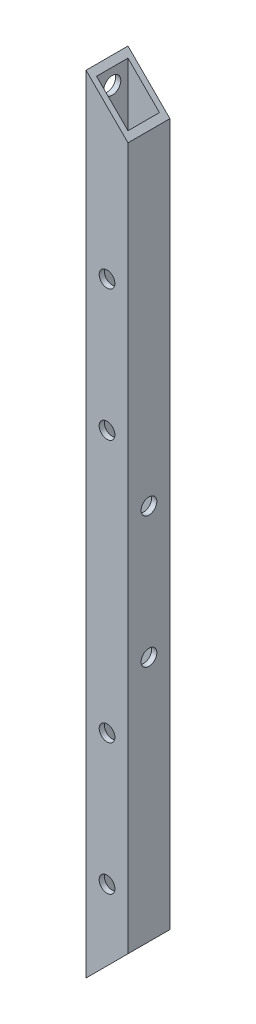
from build123d import *

# Parameters (mm, degrees)
SKETCH_1_W          = 8
SKETCH_1_H          = 8
SKETCH_1_W_2        = 6
SKETCH_1_H_2        = 6
EXTRUDE_1_DEPTH     = 150
SKETCH_2_R          = 1.5
CUT_EXTRUDE_1_DEPTH = 10
CUT_EXTRUDE_2_DEPTH = 10
SKETCH_5_R          = 1.5
CUT_EXTRUDE_3_DEPTH = 10
SKETCH_6_R          = 1.625
CUT_EXTRUDE_4_DEPTH = 10


with BuildPart() as part:
    # 草图1 → 凸台-拉伸1 (new body)
    with BuildSketch(Plane(origin=(0, 0, 0), x_dir=(1, 0, 0), z_dir=(0, 1, 0))):
        Rectangle(SKETCH_1_W, SKETCH_1_H)
        Rectangle(SKETCH_1_W_2, SKETCH_1_H_2, mode=Mode.SUBTRACT)
    extrude(amount=EXTRUDE_1_DEPTH)

    # 草图2 → 切除-拉伸1 (cut)
    with BuildSketch(Plane(origin=(4, 0, 0), x_dir=(0, 0, -1), z_dir=(1, 0, 0))):
        with Locations((0, 80)):
            Circle(SKETCH_2_R)
        with Locations((0, 55)):
            Circle(SKETCH_2_R)
    extrude(amount=-CUT_EXTRUDE_1_DEPTH, mode=Mode.SUBTRACT)

    # 草图3 → 切除-拉伸2 (cut)
    with BuildSketch(Plane(origin=(0, 0, -4), x_dir=(-1, 0, 0), z_dir=(0, 0, -1))):
        Polygon((4, 150), (-4, 142), (-4, 150), align=None)
        Polygon((4, 0), (-4, 8), (-4, 0), align=None)
    extrude(amount=-CUT_EXTRUDE_2_DEPTH, mode=Mode.SUBTRACT)

    # 草图5 → 切除-拉伸3 (cut)
    with BuildSketch(Plane.XY.offset(4)):
        with Locations((0, 42.5)):
            Circle(SKETCH_5_R)
        with Locations(Location((0, 92.5, 0), (0, 0, 180))):
            Circle(SKETCH_5_R)
        with Locations((0, 117.5)):
            Circle(SKETCH_5_R)
        with Locations((0, 17.5)):
            Circle(SKETCH_5_R)
    extrude(amount=-CUT_EXTRUDE_3_DEPTH, mode=Mode.SUBTRACT)

    # 草图6 → 切除-拉伸4 (cut)
    with BuildSketch(Plane(origin=(-3, 0, 0), x_dir=(0, 0, -1), z_dir=(1, 0, 0))):
        with Locations((0, 146)):
            Circle(SKETCH_6_R)
        with Locations((0, 4)):
            Circle(SKETCH_6_R)
    extrude(amount=-CUT_EXTRUDE_4_DEPTH, mode=Mode.SUBTRACT)


solid = part.part
